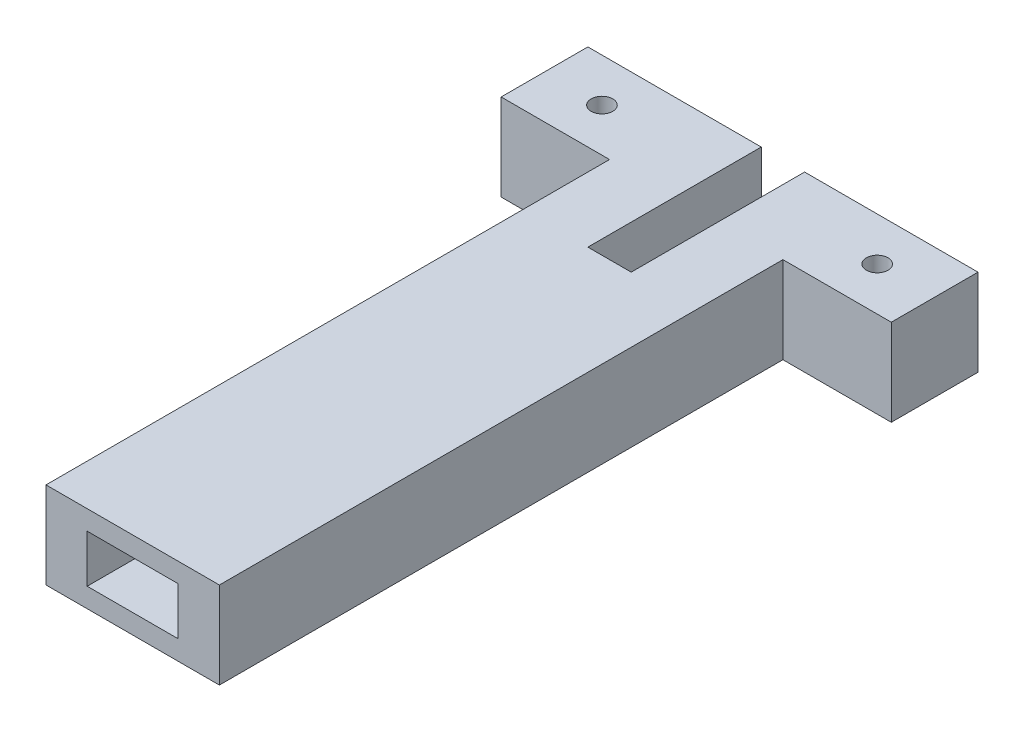
from build123d import *

# Parameters (mm, degrees)
SKETCH1_R           = 1.25
BOSS_EXTRUDE1_DEPTH = 10
SKETCH2_W           = 10.5
SKETCH2_H           = 5.5
CUT_EXTRUDE1_DEPTH  = 55


with BuildPart() as part:
    # Sketch1 → Boss-Extrude1 (new body)
    with BuildSketch(Plane(origin=(0, 0, 0), x_dir=(1, 0, 0), z_dir=(0, 1, 0))):
        Polygon((10, -5), (22.5, -5), (22.5, 5), (2.5, 5), (2.5, -15), (-2.5, -15), (-2.5, 5), (-22.5, 5), (-22.5, -5), (-10, -5), (-10, -70), (10, -70), align=None)
        with Locations(Location((-15.875, 0, 0), (0, 0, 270))):
            Circle(SKETCH1_R, mode=Mode.SUBTRACT)
        with Locations(Location((15.875, 0, 0), (0, 0, 270))):
            Circle(SKETCH1_R, mode=Mode.SUBTRACT)
    extrude(amount=BOSS_EXTRUDE1_DEPTH)

    # Sketch2 → Cut-Extrude1 (cut)
    with BuildSketch(Plane.XY.offset(70)):
        with Locations((0, 5)):
            Rectangle(SKETCH2_W, SKETCH2_H)
    extrude(amount=-CUT_EXTRUDE1_DEPTH, mode=Mode.SUBTRACT)


solid = part.part
